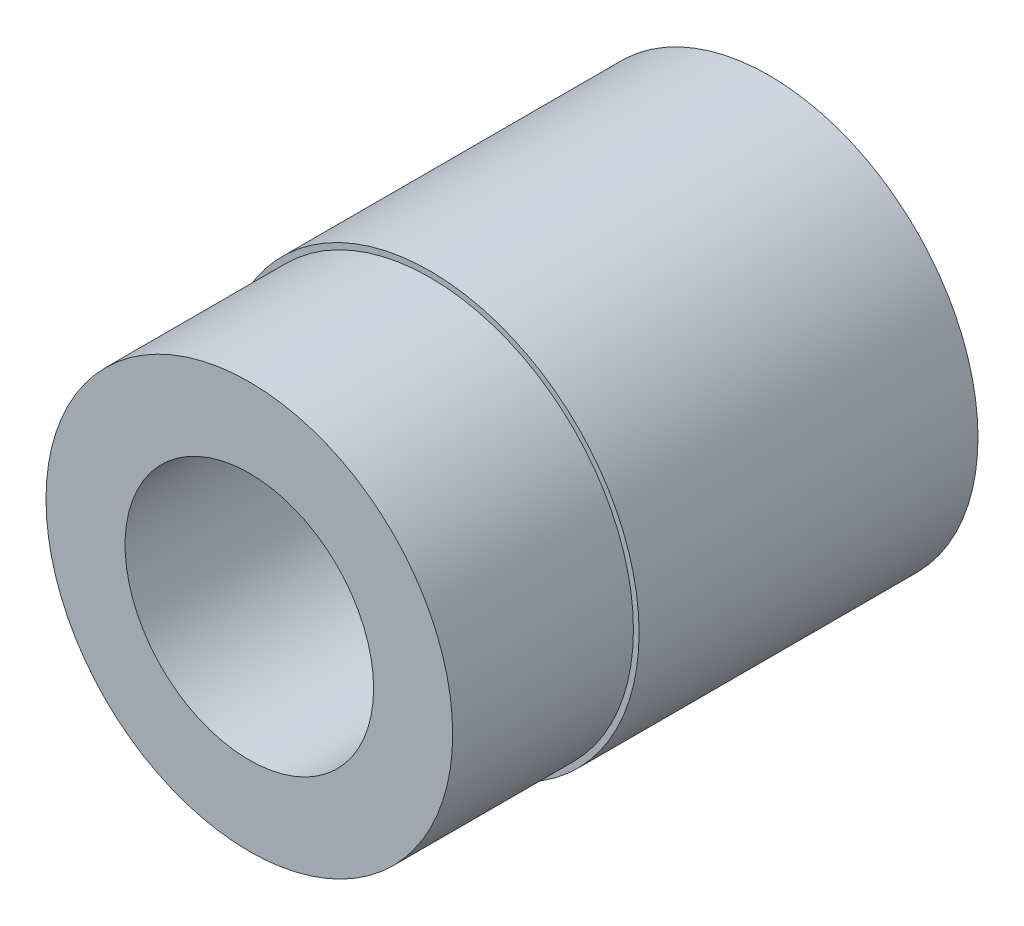
from build123d import *

# Parameters (mm, degrees)
SKETCH_1_R          = 18.5
EXTRUDE_1_DEPTH     = 30
SKETCH_2_R          = 18
EXTRUDE_2_DEPTH     = 16
SKETCH_3_R          = 11
CUT_EXTRUDE_1_DEPTH = 30


with BuildPart() as part:
    # 草图1 → 拉伸1 (new body)
    with BuildSketch(Plane.XY):
        Circle(SKETCH_1_R)
    extrude(amount=EXTRUDE_1_DEPTH)

    # 草图2 → 拉伸2 (add)
    with BuildSketch(Plane.XY.offset(30)):
        Circle(SKETCH_2_R)
    extrude(amount=EXTRUDE_2_DEPTH)

    # 草图3 → 切除-拉伸1 (cut)
    with BuildSketch(Plane.XY.offset(46)):
        Circle(SKETCH_3_R)
    extrude(amount=-CUT_EXTRUDE_1_DEPTH, mode=Mode.SUBTRACT)


solid = part.part
